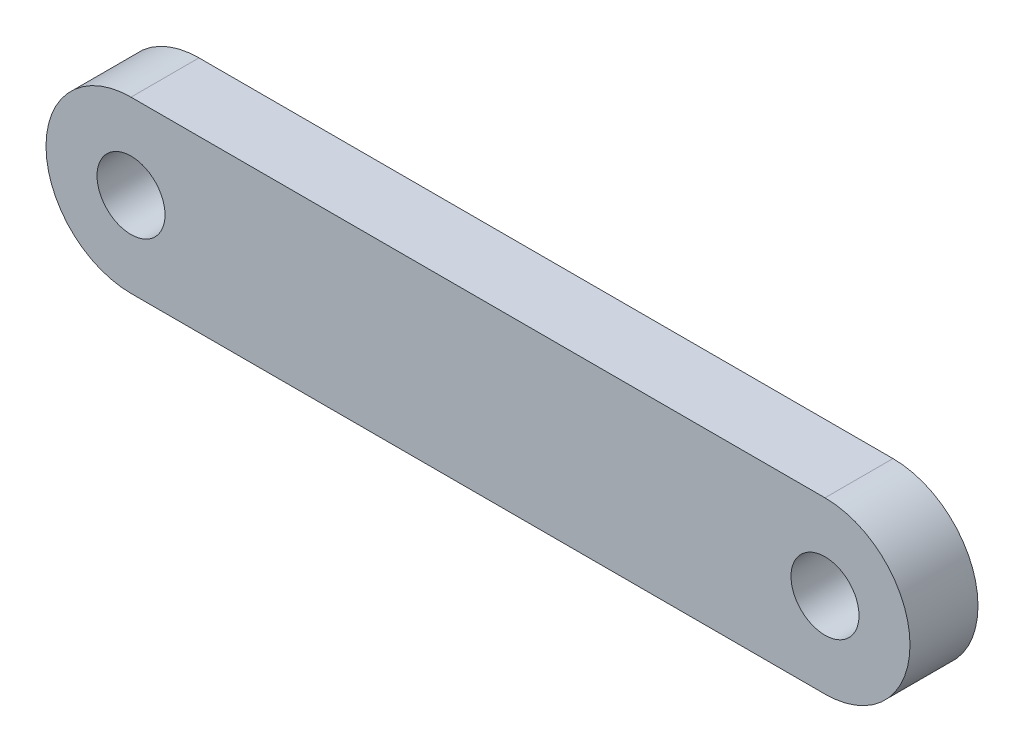
from build123d import *

# Parameters (mm, degrees)
SKETCH1_R           = 3.175
SKETCH1_R_2         = 1.27
BOSS_EXTRUDE2_DEPTH = 2.54


with BuildPart() as part:
    # Sketch1 → Boss-Extrude2 (new body)
    # profile 1 of 3: a face of its own
    with BuildSketch(Plane.XY):
        Circle(SKETCH1_R)
        Circle(SKETCH1_R_2, mode=Mode.SUBTRACT)
    # profile 2 of 3: a face of its own
    with BuildSketch(Plane.XY):
        with Locations((25.9207, 0)):
            Circle(SKETCH1_R)
        with Locations((25.9207, 0)):
            Circle(SKETCH1_R_2, mode=Mode.SUBTRACT)
    # profile 3 of 3: a face of its own
    with BuildSketch(Plane.XY):
        with BuildLine():
            Line((25.9207, 3.175), (0, 3.175))
            ThreePointArc((0, 3.175), (2.24506403, 2.24506403), (3.175, 0))
            ThreePointArc((3.175, 0), (2.24506403, -2.24506403), (0, -3.175))
            Line((0, -3.175), (25.9207, -3.175))
            ThreePointArc((25.9207, -3.175), (22.7457, 0), (25.9207, 3.175))
        make_face()
    extrude(amount=BOSS_EXTRUDE2_DEPTH)


solid = part.part
